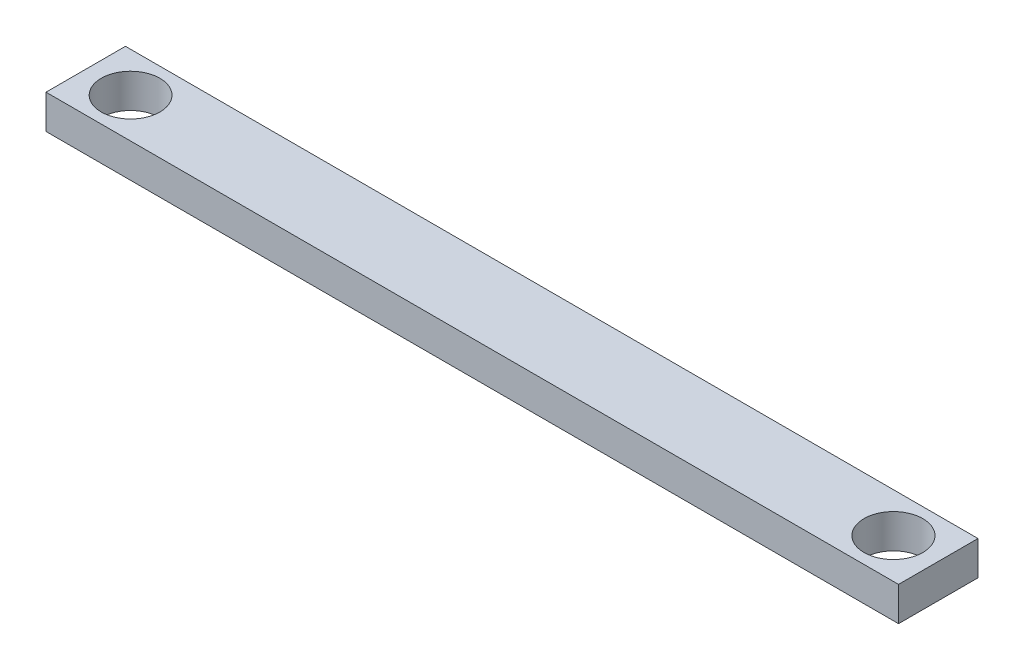
from build123d import *

# Parameters (mm, degrees)
SKETCH1_W           = 75.1
SKETCH1_H           = 7
SKETCH1_R           = 2.58
SKETCH1_R_2         = 2.59
BOSS_EXTRUDE1_DEPTH = 3


with BuildPart() as part:
    # Sketch1 → Boss-Extrude1 (new body)
    with BuildSketch(Plane(origin=(0, 0, 0), x_dir=(1, 0, 0), z_dir=(0, 1, 0))):
        with Locations((-10.05, 1)):
            Rectangle(SKETCH1_W, SKETCH1_H)
        with Locations(Location((-43.65, 1, 0), (0, 0, 270))):
            Circle(SKETCH1_R, mode=Mode.SUBTRACT)
        with Locations(Location((23.55, 1, 0), (0, 0, 270))):
            Circle(SKETCH1_R_2, mode=Mode.SUBTRACT)
    extrude(amount=BOSS_EXTRUDE1_DEPTH)


solid = part.part
